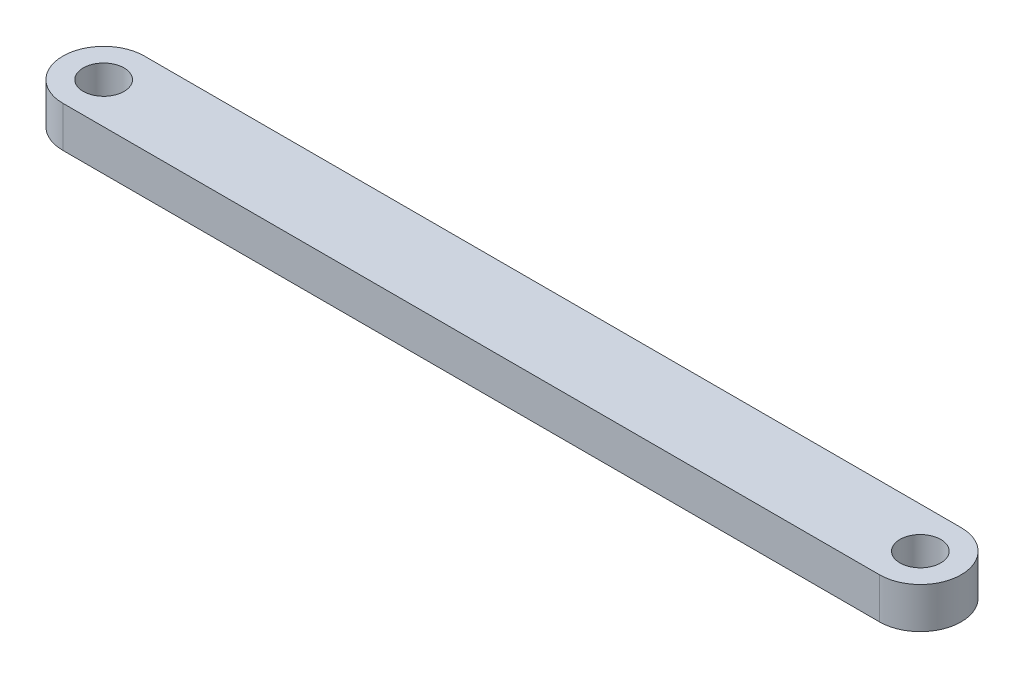
from build123d import *

# Parameters (mm, degrees)
SKETCH_1_R      = 1.5
EXTRUDE_1_DEPTH = 3


with BuildPart() as part:
    # 草图1 → 凸台-拉伸1 (new body)
    with BuildSketch(Plane(origin=(0, 0, 0), x_dir=(1, 0, 0), z_dir=(0, 1, 0))):
        with BuildLine():
            Line((0, 3), (-60, 3))
            ThreePointArc((-60, 3), (-63, 0), (-60, -3))
            Line((-60, -3), (0, -3))
            ThreePointArc((0, -3), (3, 0), (0, 3))
        make_face()
        with Locations(Location((0, 0, 0), (0, 0, 270))):
            Circle(SKETCH_1_R, mode=Mode.SUBTRACT)
        with Locations(Location((-60, 0, 0), (0, 0, 270))):
            Circle(SKETCH_1_R, mode=Mode.SUBTRACT)
    extrude(amount=EXTRUDE_1_DEPTH)


solid = part.part
